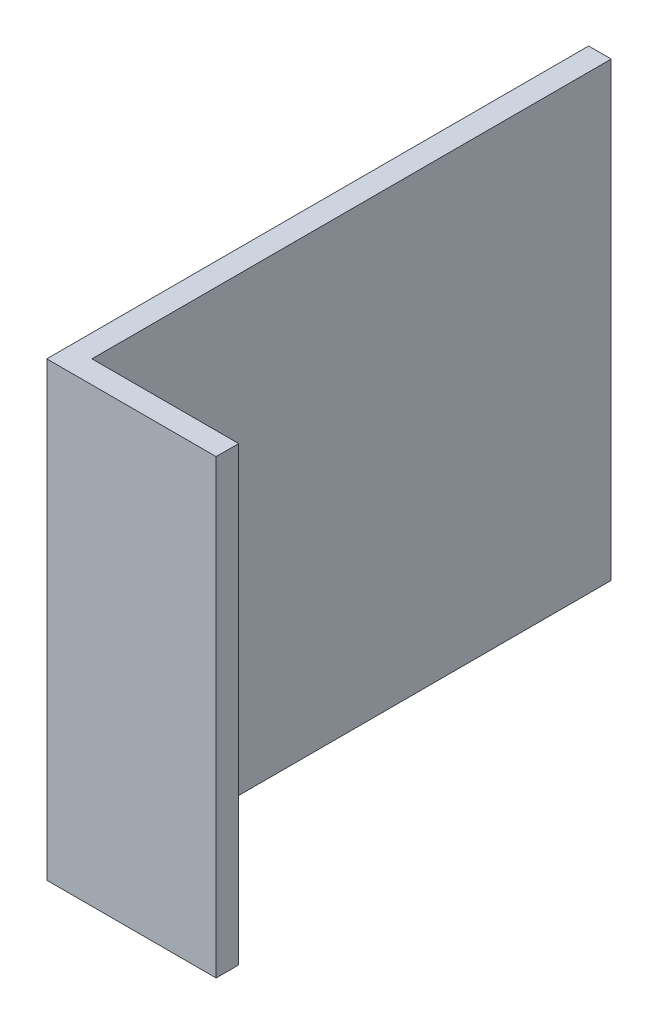
from build123d import *

# Parameters (mm, degrees)
BOSS_EXTRUDE1_DEPTH = 63.5


with BuildPart() as part:
    # Sketch1 → Boss-Extrude1 (new body)
    with BuildSketch(Plane(origin=(0, 0, 0), x_dir=(1, 0, 0), z_dir=(0, 1, 0))):
        Polygon((0, 76.2), (0, 0), (23.8125, 0), (23.8125, 3.175), (3.175, 3.175), (3.175, 76.2), align=None)
    extrude(amount=BOSS_EXTRUDE1_DEPTH)


solid = part.part
